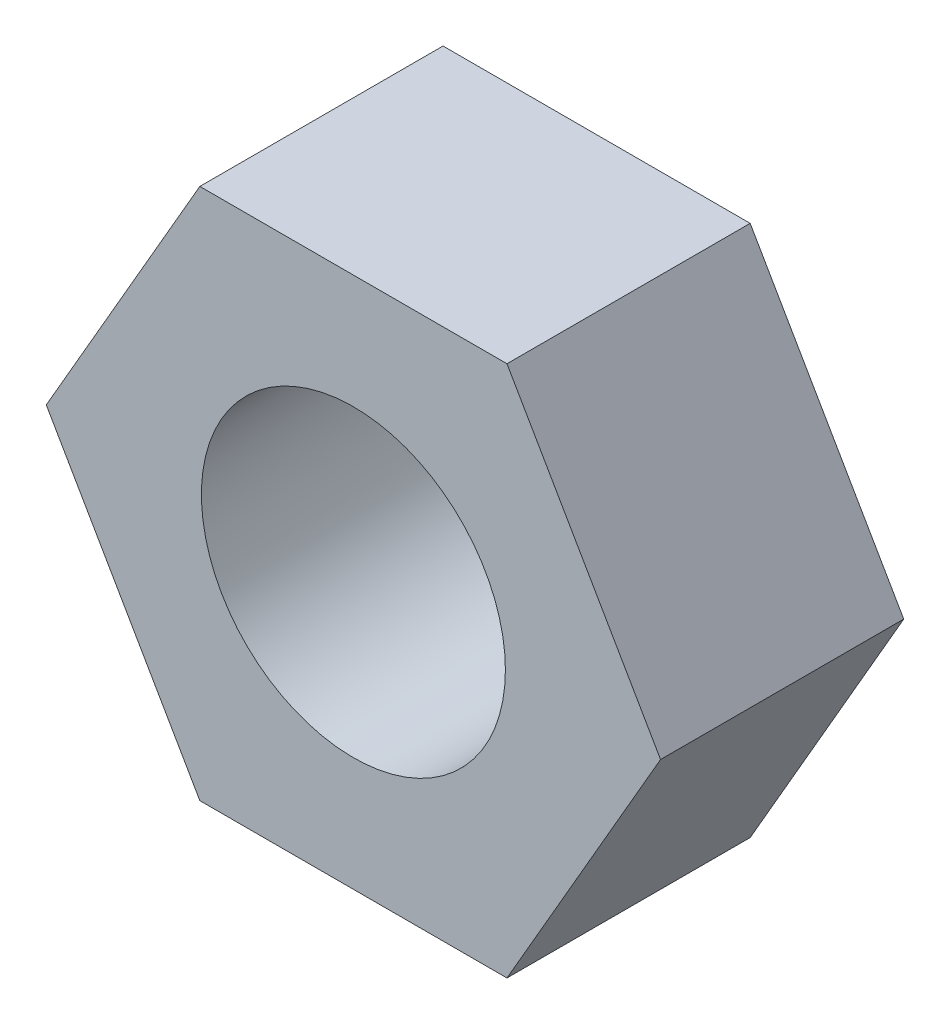
from build123d import *

# Parameters (mm, degrees)
SKETCH_1_R      = 2
EXTRUDE_1_DEPTH = 1.6


with BuildPart() as part:
    # 草图1 → 凸台-拉伸1 (new, symmetric)
    with BuildSketch(Plane.XY):
        Polygon((4.041451884, 0), (2.020725942, 3.5), (-2.020725942, 3.5), (-4.041451884, 0), (-2.020725942, -3.5), (2.020725942, -3.5), align=None)
        Circle(SKETCH_1_R, mode=Mode.SUBTRACT)
    extrude(amount=EXTRUDE_1_DEPTH, both=True)


solid = part.part
